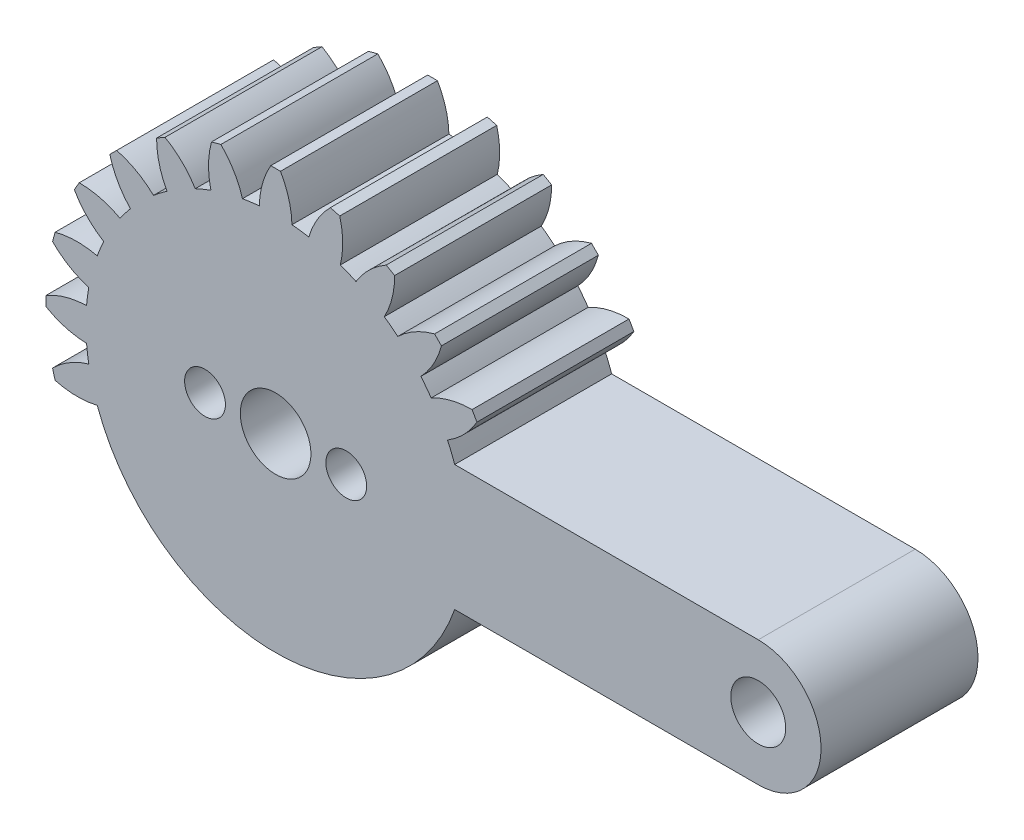
from build123d import *

# Parameters (mm, degrees)
SKETCH1_R           = 1.75
BOSS_EXTRUDE1_DEPTH = 10
SKETCH2_R           = 1.3
SKETCH2_R_2         = 2.25
CUT_EXTRUDE1_DEPTH  = 40.007683858


with BuildPart() as part:
    # Sketch1 → Boss-Extrude1 (new body)
    with BuildSketch(Plane.XY):
        with BuildLine():
            Line((0.31, 14.63), (-0.31, 14.63))
            ThreePointArc((-0.31, 14.63), (-0.838273314, 13.383704325), (-1.04, 12.04518576))
            ThreePointArc((-1.04, 12.04518576), (-1.578061664, 11.986568374), (-2.112960617, 11.903927815))
            ThreePointArc((-2.112960617, 11.903927815), (-2.65424773, 13.144626757), (-3.487085624, 14.211728743))
            Line((-3.487085624, 14.211728743), (-4.085959636, 14.051260935))
            ThreePointArc((-4.085959636, 14.051260935), (-4.273667417, 12.71070456), (-4.122086336, 11.365584201))
            ThreePointArc((-4.122086336, 11.365584201), (-4.626642697, 11.169703548), (-5.12192646, 10.951436862))
            ThreePointArc((-5.12192646, 10.951436862), (-5.965886177, 12.009764599), (-7.046532125, 12.824951657))
            Line((-7.046532125, 12.824951657), (-7.583467875, 12.514951657))
            ThreePointArc((-7.583467875, 12.514951657), (-7.417818147, 11.171491285), (-6.9232593, 9.911436862))
            ThreePointArc((-6.9232593, 9.911436862), (-7.359925677, 9.591641884), (-7.781841479, 9.252623584))
            ThreePointArc((-7.781841479, 9.252623584), (-8.870959341, 10.05645683), (-10.125769107, 10.564175311))
            Line((-10.125769107, 10.564175311), (-10.564175311, 10.125769107))
            ThreePointArc((-10.564175311, 10.125769107), (-10.05645683, 8.870959341), (-9.252623584, 7.781841479))
            ThreePointArc((-9.252623584, 7.781841479), (-9.591641884, 7.359925677), (-9.911436862, 6.9232593))
            ThreePointArc((-9.911436862, 6.9232593), (-11.171491285, 7.417818147), (-12.514951657, 7.583467875))
            Line((-12.514951657, 7.583467875), (-12.824951657, 7.046532125))
            ThreePointArc((-12.824951657, 7.046532125), (-12.009764599, 5.965886177), (-10.951436862, 5.12192646))
            ThreePointArc((-10.951436862, 5.12192646), (-11.169703548, 4.626642697), (-11.365584201, 4.122086336))
            ThreePointArc((-11.365584201, 4.122086336), (-12.71070456, 4.273667417), (-14.051260935, 4.085959636))
            Line((-14.051260935, 4.085959636), (-14.211728743, 3.487085624))
            ThreePointArc((-14.211728743, 3.487085624), (-13.144626757, 2.65424773), (-11.903927815, 2.112960617))
            ThreePointArc((-11.903927815, 2.112960617), (-11.986568374, 1.578061664), (-12.04518576, 1.04))
            ThreePointArc((-12.04518576, 1.04), (-13.383704325, 0.838273314), (-14.63, 0.31))
            Line((-14.63, 0.31), (-14.63, -0.31))
            ThreePointArc((-14.63, -0.31), (-13.383704325, -0.838273314), (-12.04518576, -1.04))
            ThreePointArc((-12.04518576, -1.04), (-11.986568374, -1.578061664), (-11.903927815, -2.112960617))
            ThreePointArc((-11.903927815, -2.112960617), (-13.144626757, -2.65424773), (-14.211728743, -3.487085624))
            Line((-14.211728743, -3.487085624), (-14.051260935, -4.085959636))
            ThreePointArc((-14.051260935, -4.085959636), (-12.71070456, -4.273667417), (-11.365584201, -4.122086336))
            ThreePointArc((-11.365584201, -4.122086336), (0.064808849, -12.089826294), (11.409123542, -4))
            Line((11.409123542, -4), (30.75, -4))
            ThreePointArc((30.75, -4), (34.75, 0), (30.75, 4))
            Line((30.75, 4), (11.409123542, 4))
            ThreePointArc((11.409123542, 4), (11.194344337, 4.566700654), (10.951436862, 5.12192646))
            ThreePointArc((10.951436862, 5.12192646), (12.009764599, 5.965886177), (12.824951657, 7.046532125))
            Line((12.824951657, 7.046532125), (12.514951657, 7.583467875))
            ThreePointArc((12.514951657, 7.583467875), (11.171491285, 7.417818147), (9.911436862, 6.9232593))
            ThreePointArc((9.911436862, 6.9232593), (9.591641884, 7.359925677), (9.252623584, 7.781841479))
            ThreePointArc((9.252623584, 7.781841479), (10.05645683, 8.870959341), (10.564175311, 10.125769107))
            Line((10.564175311, 10.125769107), (10.125769107, 10.564175311))
            ThreePointArc((10.125769107, 10.564175311), (8.870959341, 10.05645683), (7.781841479, 9.252623584))
            ThreePointArc((7.781841479, 9.252623584), (7.359925677, 9.591641884), (6.9232593, 9.911436862))
            ThreePointArc((6.9232593, 9.911436862), (7.417818147, 11.171491285), (7.583467875, 12.514951657))
            Line((7.583467875, 12.514951657), (7.046532125, 12.824951657))
            ThreePointArc((7.046532125, 12.824951657), (5.965886177, 12.009764599), (5.12192646, 10.951436862))
            ThreePointArc((5.12192646, 10.951436862), (4.626642697, 11.169703548), (4.122086336, 11.365584201))
            ThreePointArc((4.122086336, 11.365584201), (4.273667417, 12.71070456), (4.085959636, 14.051260935))
            Line((4.085959636, 14.051260935), (3.487085624, 14.211728743))
            ThreePointArc((3.487085624, 14.211728743), (2.65424773, 13.144626757), (2.112960617, 11.903927815))
            ThreePointArc((2.112960617, 11.903927815), (1.578061664, 11.986568374), (1.04, 12.04518576))
            ThreePointArc((1.04, 12.04518576), (0.838273314, 13.383704325), (0.31, 14.63))
        make_face()
        Circle(SKETCH1_R, mode=Mode.SUBTRACT)
        with Locations((30.75, 0)):
            Circle(SKETCH1_R, mode=Mode.SUBTRACT)
    extrude(amount=BOSS_EXTRUDE1_DEPTH)

    # Sketch2 → Cut-Extrude1 (cut, through all)
    with BuildSketch(Plane.XY.offset(10)):
        with Locations((-4.5, 0)):
            Circle(SKETCH2_R)
        with Locations((4.5, 0)):
            Circle(SKETCH2_R)
        Circle(SKETCH2_R_2)
    extrude(amount=-CUT_EXTRUDE1_DEPTH, mode=Mode.SUBTRACT)


solid = part.part
